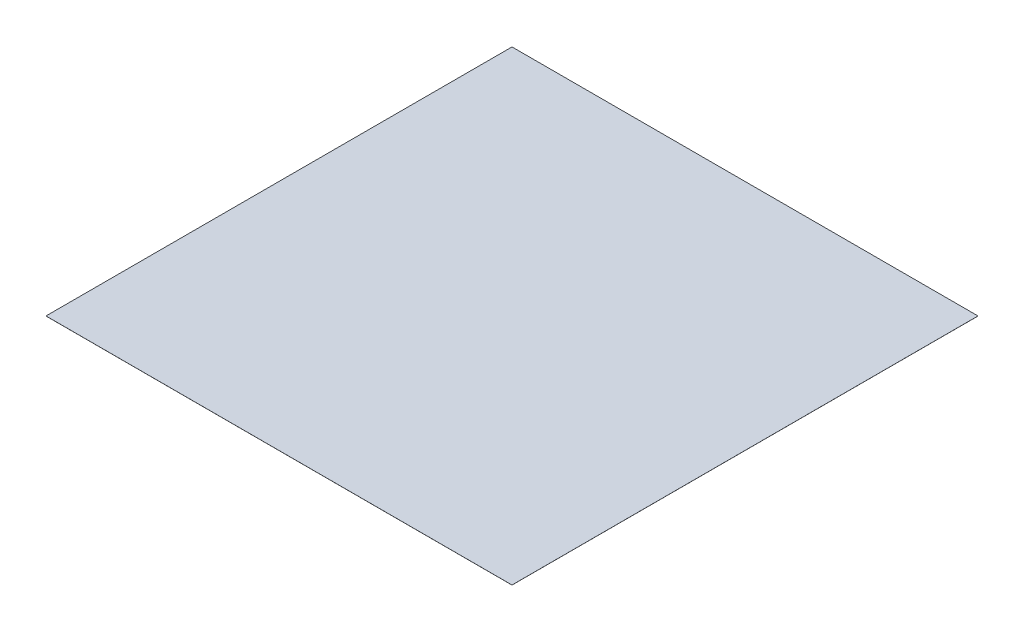
from build123d import *

# Parameters (mm, degrees)
SKETCH1_W           = 6000
SKETCH1_H           = 6000
BOSS_EXTRUDE1_DEPTH = 1


with BuildPart() as part:
    # Sketch1 → Boss-Extrude1 (new body)
    with BuildSketch(Plane(origin=(0, 0, 0), x_dir=(1, 0, 0), z_dir=(0, 1, 0))):
        Rectangle(SKETCH1_W, SKETCH1_H)
    extrude(amount=BOSS_EXTRUDE1_DEPTH)


solid = part.part
